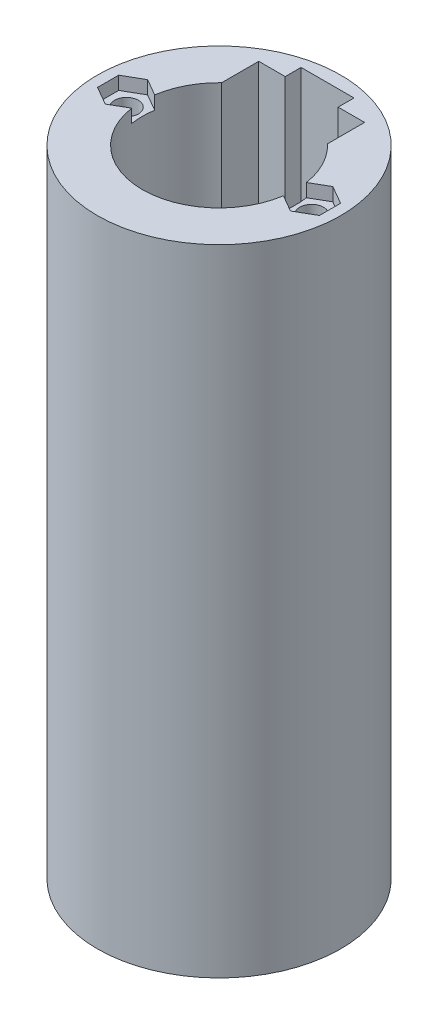
from build123d import *

# Parameters (mm, degrees)
SKETCH1_R           = 23
BOSS_EXTRUDE1_DEPTH = 120
SKETCH2_R           = 14.5
CUT_EXTRUDE1_DEPTH  = 120
CUT_EXTRUDE2_DEPTH  = 2.5
SKETCH5_R           = 2.25
CUT_EXTRUDE3_DEPTH  = 10
BOSS_EXTRUDE2_START = -7
SKETCH6_R           = 14.5
BOSS_EXTRUDE2_DEPTH = 7
SKETCH7_R           = 4
CUT_EXTRUDE4_DEPTH  = 15
CUT_EXTRUDE6_DEPTH  = 25
CUT_EXTRUDE7_DEPTH  = 25


with BuildPart() as part:
    # Sketch1 → Boss-Extrude1 (new body)
    with BuildSketch(Plane(origin=(0, 0, 0), x_dir=(1, 0, 0), z_dir=(0, 1, 0))):
        with Locations(Location((0, 0, 0), (0, 0, 270))):
            Circle(SKETCH1_R)
    extrude(amount=BOSS_EXTRUDE1_DEPTH)

    # Sketch2 → Cut-Extrude1 (cut)
    with BuildSketch(Plane(origin=(0, 120, 0), x_dir=(1, 0, 0), z_dir=(0, 1, 0))):
        with Locations(Location((0, 0, 0), (0, 0, 270))):
            Circle(SKETCH2_R)
    extrude(amount=-CUT_EXTRUDE1_DEPTH, mode=Mode.SUBTRACT)

    # Sketch4 → Cut-Extrude2 (cut)
    with BuildSketch(Plane(origin=(0, 120, 0), x_dir=(1, 0, 0), z_dir=(0, 1, 0))):
        Polygon((-17.5, 4), (-20.964101615, 2), (-20.964101615, -2), (-17.5, -4), (-14.035898385, -2), (-14.035898385, 2), align=None)
        Polygon((14.035898385, 2), (17.5, 4), (20.964101615, 2), (20.964101615, -2), (17.5, -4), (14.035898385, -2), align=None)
    extrude(amount=-CUT_EXTRUDE2_DEPTH, mode=Mode.SUBTRACT)

    # Sketch5 → Cut-Extrude3 (cut)
    with BuildSketch(Plane(origin=(0, 117.5, 0), x_dir=(1, 0, 0), z_dir=(0, 1, 0))):
        with Locations(Location((-17.5, 0, 0), (0, 0, 270))):
            Circle(SKETCH5_R)
        with Locations(Location((17.5, 0, 0), (0, 0, 90))):
            Circle(SKETCH5_R)
    extrude(amount=-CUT_EXTRUDE3_DEPTH, mode=Mode.SUBTRACT)

    # Sketch6 → Boss-Extrude2 (add)
    with BuildSketch(Plane(origin=(0, 0, 0), x_dir=(-1, 0, 0), z_dir=(0, -1, 0)).offset(BOSS_EXTRUDE2_START)):
        with Locations(Location((0, 0, 0), (0, 0, 188.620433548))):
            Circle(SKETCH6_R)
    extrude(amount=BOSS_EXTRUDE2_DEPTH)

    # Sketch7 → Cut-Extrude4 (cut)
    with BuildSketch(Plane.XZ):
        with Locations(Location((0, 0, 0), (0, 0, 270))):
            Circle(SKETCH7_R)
    extrude(amount=-CUT_EXTRUDE4_DEPTH, mode=Mode.SUBTRACT)

    # Sketch8 → Cut-Extrude6 (cut)
    with BuildSketch(Plane(origin=(0, 120, 0), x_dir=(1, 0, 0), z_dir=(0, 1, 0))):
        with BuildLine():
            Line((-10, 10.5), (-10, 17.5))
            Line((-10, 17.5), (10, 17.5))
            Line((10, 17.5), (10, 10.5))
            ThreePointArc((10, 10.5), (0, 14.5), (-10, 10.5))
        make_face()
    extrude(amount=-CUT_EXTRUDE6_DEPTH, mode=Mode.SUBTRACT)

    # Sketch9 → Cut-Extrude7 (cut)
    with BuildSketch(Plane(origin=(0, 120, 0), x_dir=(1, 0, 0), z_dir=(0, 1, 0))):
        Polygon((0, 17.5), (-5, 17.5), (-5, 20.5), (5, 20.5), (5, 17.5), align=None)
    extrude(amount=-CUT_EXTRUDE7_DEPTH, mode=Mode.SUBTRACT)


solid = part.part
